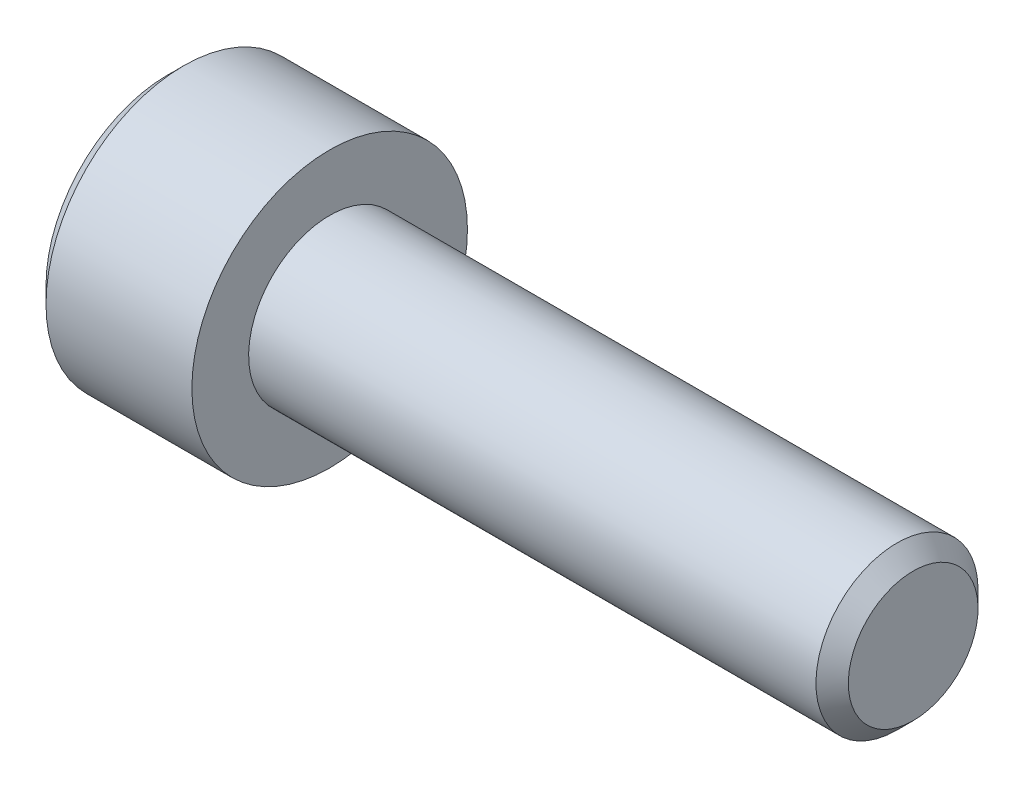
from build123d import *

# Parameters (mm, degrees)
CHAMFER1_SIZE      = 0.5
CUT_EXTRUDE1_DEPTH = 2.5


with BuildPart() as part:
    # Sketch1 → Revolve1 (revolve)
    with BuildSketch(Plane.XY, mode=Mode.PRIVATE) as revolve1_sk:
        Polygon((-5, 0), (-5, 3.75), (-4.5, 4.25), (0, 4.25), (0, 2.5), (18, 2.5), (18, 0), align=None)
    revolve(revolve1_sk.sketch.rotate(Axis((18, 0, 0), (-1, 0, 0)), 180), axis=Axis((18, 0, 0), (-1, 0, 0)))

    # Chamfer1
    chamfer1_edges = [part.edges().sort_by_distance(p)[0] for p in [
        (18, 2.5, 0),
    ]]
    chamfer(chamfer1_edges, length=CHAMFER1_SIZE)

    # Sketch2 → Cut-Revolve1 (revolve, cut)
    with BuildSketch(Plane.XY, mode=Mode.PRIVATE) as cut_revolve1_sk:
        Polygon((-5, 0), (-5, 2), (-2.5, 2), (-1.964101615, 0), align=None)
    revolve(cut_revolve1_sk.sketch.rotate(Axis((-1.964101615, 0, 0), (-1, 0, 0)), 270), axis=Axis((-1.964101615, 0, 0), (-1, 0, 0)), mode=Mode.SUBTRACT)

    # Sketch3 → Cut-Extrude1 (cut)
    with BuildSketch(Plane(origin=(-5, 0, 0), x_dir=(0, 0, -1), z_dir=(1, 0, 0))):
        Polygon((-2, 1.154700538), (-2, -1.154700538), (0, -2.309401077), (2, -1.154700538), (2, 1.154700538), (0, 2.309401077), align=None)
    extrude(amount=CUT_EXTRUDE1_DEPTH, mode=Mode.SUBTRACT)


solid = part.part
